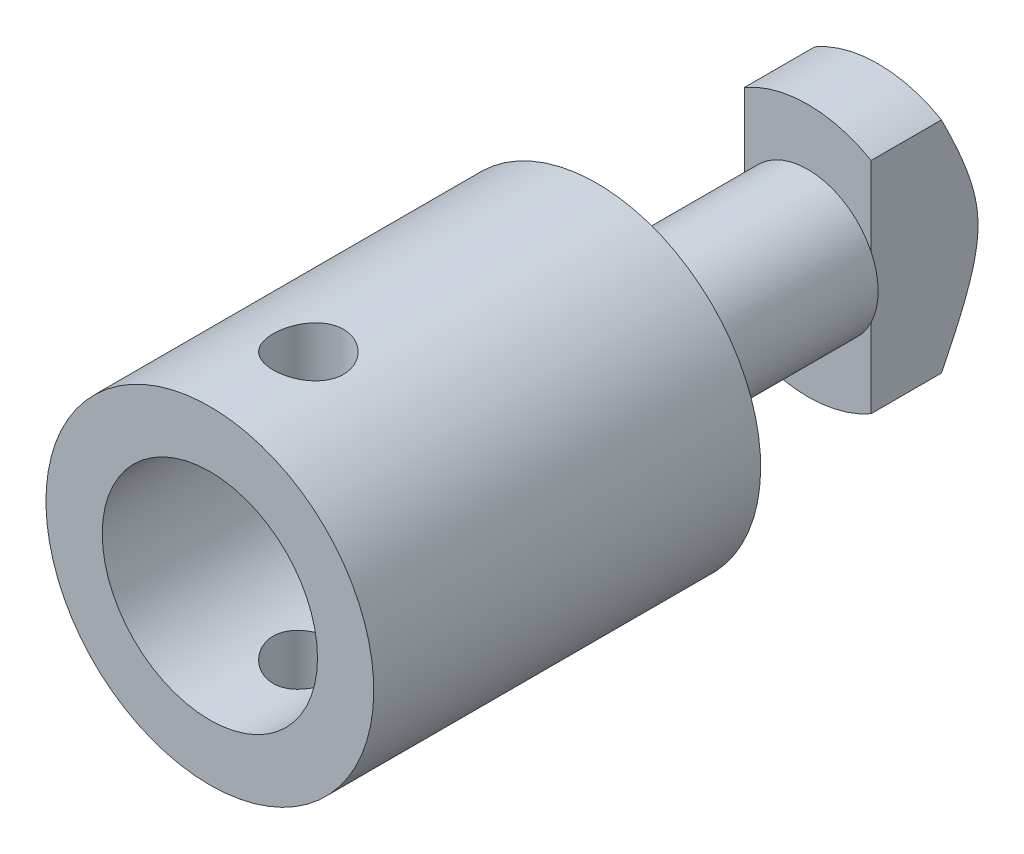
from build123d import *

# Parameters (mm, degrees)
CUT_EXTRUDE1_START      = -8.5
SKETCH2_W               = 5
SKETCH2_H               = 10
CUT_EXTRUDE1_DEPTH      = 3.542335768
CUT_EXTRUDE2_DEPTH      = 12.042335768
CUT_EXTRUDE2_DEPTH_BACK = 12.042335768
SKETCH3_R               = 0.5


with BuildPart() as part:
    # Sketch1 → Revolve1 (revolve)
    with BuildSketch(Plane(origin=(0, 0, 0), x_dir=(0, 0, -1), z_dir=(1, 0, 0)), mode=Mode.PRIVATE) as revolve1_sk:
        Polygon((0, 2.33), (5.5, 2.33), (5.5, 1), (8.5, 1), (8.5, 1.8), (9.5, 1.8), (10.539230485, 0), (4, 0), (4, 1.53), (0, 1.53), align=None)
    revolve(revolve1_sk.sketch.rotate(Axis((0, 0, 2.965537871), (0, 0, -1)), 180), axis=Axis((0, 0, 2.965537871), (0, 0, -1)))

    # Sketch2 → Cut-Extrude1 (cut, through all)
    with BuildSketch(Plane.XY.offset(CUT_EXTRUDE1_START)):
        with Locations((3.4, 0)):
            Rectangle(SKETCH2_W, SKETCH2_H)
        with Locations((-3.4, 0)):
            Rectangle(SKETCH2_W, SKETCH2_H)
    extrude(amount=-CUT_EXTRUDE1_DEPTH, mode=Mode.SUBTRACT)

    # Sketch3 → Cut-Extrude2 (cut, two sides: drawn at the far end of the back side and taken through both)
    with BuildSketch(Plane(origin=(0, 0, 0), x_dir=(1, 0, 0), z_dir=(0, 1, 0)).offset(-CUT_EXTRUDE2_DEPTH_BACK)):
        with Locations(Location((0, 1.4, 0), (0, 0, 270))):
            Circle(SKETCH3_R)
    extrude(amount=CUT_EXTRUDE2_DEPTH + CUT_EXTRUDE2_DEPTH_BACK, mode=Mode.SUBTRACT)


solid = part.part
